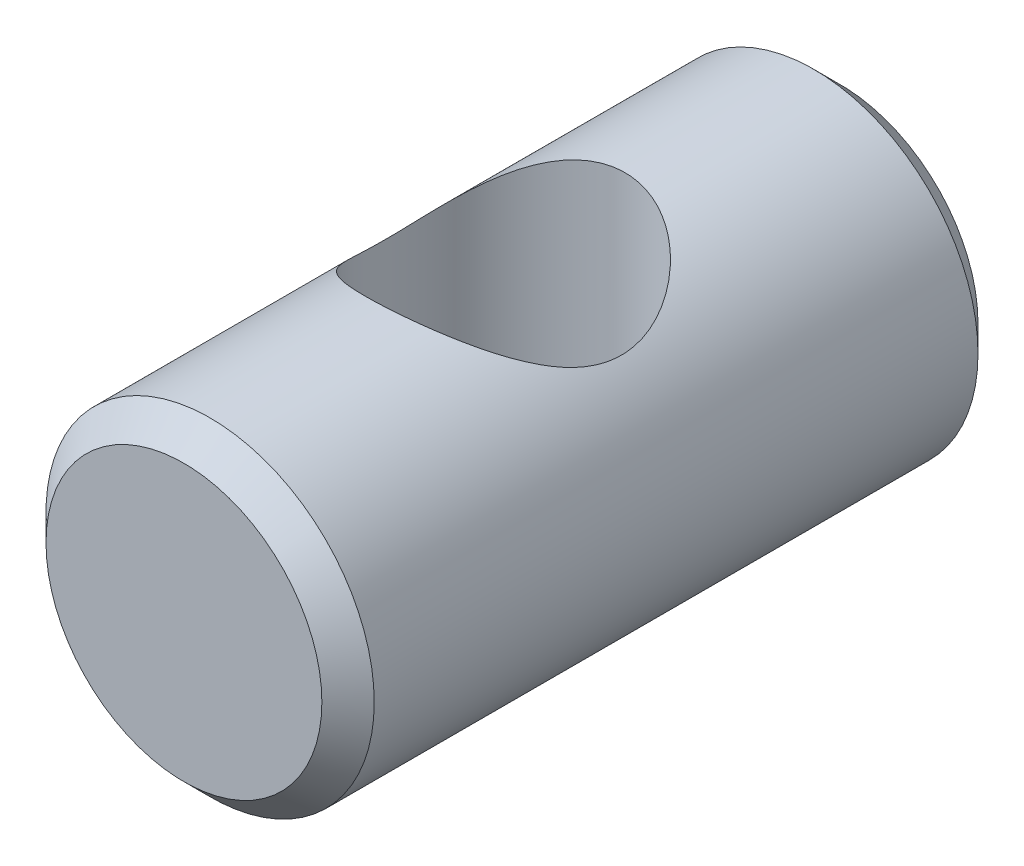
from build123d import *

# Parameters (mm, degrees)
SKETCH1_R               = 4.765
BOSS_EXTRUDE1_DEPTH     = 9.525
CUT_EXTRUDE1_DEPTH      = 12.667736499
CUT_EXTRUDE1_DEPTH_BACK = 12.667736499
SKETCH2_R               = 3.43
CHAMFER1_SIZE           = 0.76


with BuildPart() as part:
    # Sketch1 → Boss-Extrude1 (new, symmetric)
    with BuildSketch(Plane.XY):
        with Locations(Location((0, 0, 0), (0, 0, 180))):
            Circle(SKETCH1_R)
    extrude(amount=BOSS_EXTRUDE1_DEPTH, both=True)

    # Sketch2 → Cut-Extrude1 (cut, two sides: drawn at the far end of the back side and taken through both)
    with BuildSketch(Plane(origin=(0, 0, 0), x_dir=(1, 0, 0), z_dir=(0, 1, 0)).offset(-CUT_EXTRUDE1_DEPTH_BACK)):
        with Locations(Location((-0.25, 0, 0), (0, 0, 270))):
            Circle(SKETCH2_R)
    extrude(amount=CUT_EXTRUDE1_DEPTH + CUT_EXTRUDE1_DEPTH_BACK, mode=Mode.SUBTRACT)

    # Chamfer1
    chamfer1_edges = [part.edges().sort_by_distance(p)[0] for p in [
        (4.765, 0, -9.525),
        (4.765, 0, 9.525),
    ]]
    chamfer(chamfer1_edges, length=CHAMFER1_SIZE)


solid = part.part
